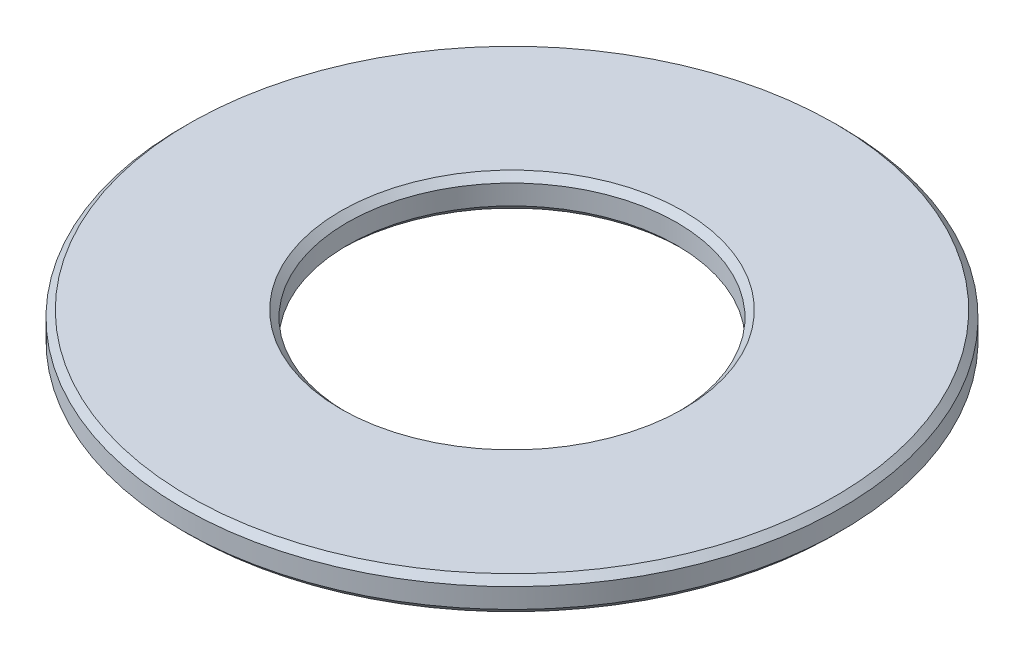
from build123d import *

# Parameters (mm, degrees)
SKETCH_2_R      = 10
SKETCH_2_R_2    = 5
EXTRUDE_1_DEPTH = 0.5
CHAMFER_1_SIZE  = 0.2


with BuildPart() as part:
    # 草图2 → 凸台-拉伸1 (new, symmetric)
    with BuildSketch(Plane(origin=(0, 0, 0), x_dir=(1, 0, 0), z_dir=(0, 1, 0))):
        with Locations(Location((0, 0, 0), (0, 0, 270))):
            Circle(SKETCH_2_R)
        with Locations(Location((0, 0, 0), (0, 0, 270))):
            Circle(SKETCH_2_R_2, mode=Mode.SUBTRACT)
    extrude(amount=EXTRUDE_1_DEPTH, both=True)

    # 倒角1
    chamfer_1_edges = [part.edges().sort_by_distance(p)[0] for p in [
        (0, -0.5, -10),
        (0, 0.5, -10),
        (0, -0.5, -5),
        (0, 0.5, -5),
    ]]
    chamfer(chamfer_1_edges, length=CHAMFER_1_SIZE)


solid = part.part
